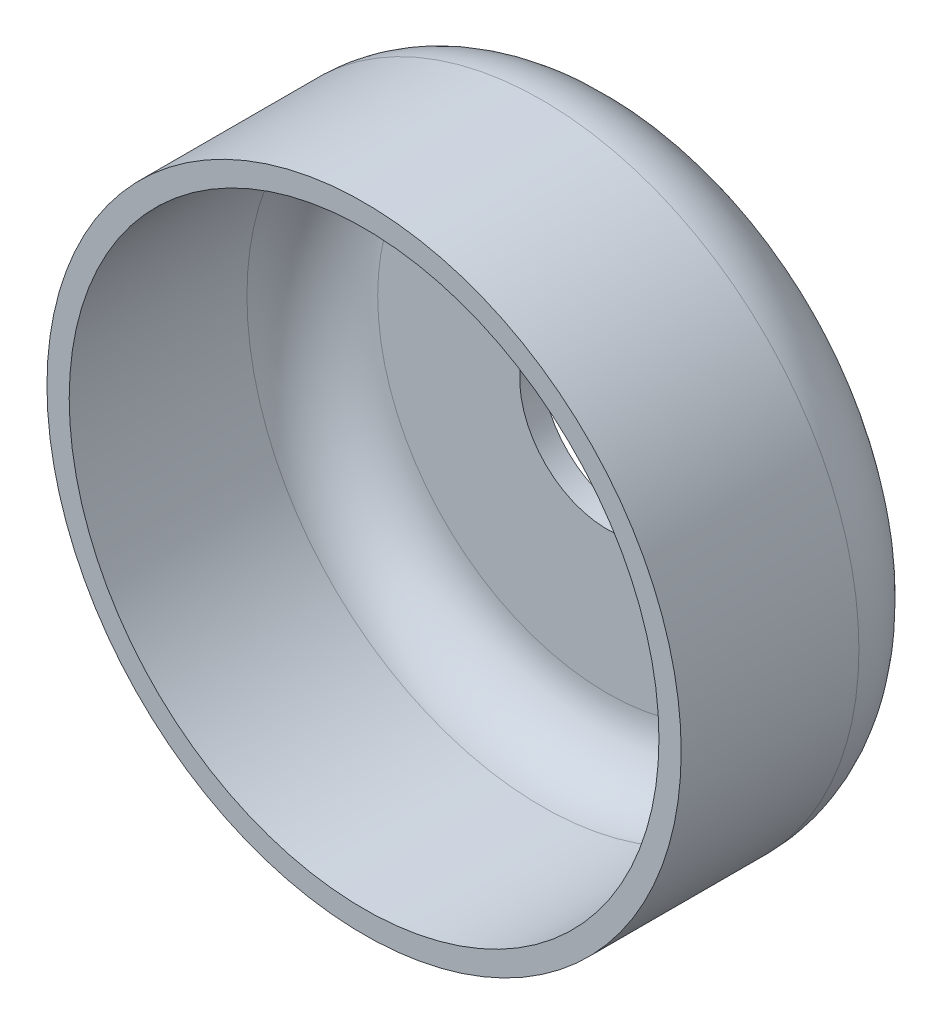
from build123d import *

# Parameters (mm, degrees)
CUT_EXTRUDE1_DEPTH      = 21.261822212
CUT_EXTRUDE1_DEPTH_BACK = 21.261822212
SKETCH2_W               = 23.9014
SKETCH2_H               = 12.352
SKETCH3_R               = 3.3
CUT_EXTRUDE2_DEPTH      = 20.224386664


with BuildPart() as part:
    # Sketch1 → Revolve1 (revolve)
    with BuildSketch(Plane(origin=(0, 0, 0), x_dir=(0, 0, -1), z_dir=(1, 0, 0)), mode=Mode.PRIVATE) as revolve1_sk:
        with BuildLine():
            Line((-11.176, 11.9507), (-11.176, 11.1125))
            Line((-11.176, 11.1125), (7.874, 11.1125))
            ThreePointArc((7.874, 11.1125), (9.616169687, 10.390869687), (10.3378, 8.6487))
            Line((10.3378, 8.6487), (10.3378, 0))
            Line((10.3378, 0), (11.176, 0))
            Line((11.176, 0), (11.176, 8.6487))
            ThreePointArc((11.176, 8.6487), (10.208866591, 10.983566591), (7.874, 11.9507))
            Line((7.874, 11.9507), (-11.176, 11.9507))
        make_face()
    revolve(revolve1_sk.sketch.rotate(Axis((0, 0, 11.176), (0, 0, -1)), 90), axis=Axis((0, 0, 11.176), (0, 0, -1)))

    # Sketch2 → Cut-Extrude1 (cut, two sides: drawn at the far end of the back side and taken through both)
    with BuildSketch(Plane(origin=(0, 0, 0), x_dir=(1, 0, 0), z_dir=(0, 1, 0)).offset(-CUT_EXTRUDE1_DEPTH_BACK)):
        with Locations((0, -5)):
            Rectangle(SKETCH2_W, SKETCH2_H)
    extrude(amount=CUT_EXTRUDE1_DEPTH + CUT_EXTRUDE1_DEPTH_BACK, mode=Mode.SUBTRACT)

    # Sketch3 → Cut-Extrude2 (cut, through all)
    with BuildSketch(Plane.XY.offset(-10.3378)):
        Circle(SKETCH3_R)
    extrude(amount=-CUT_EXTRUDE2_DEPTH, mode=Mode.SUBTRACT)


solid = part.part
